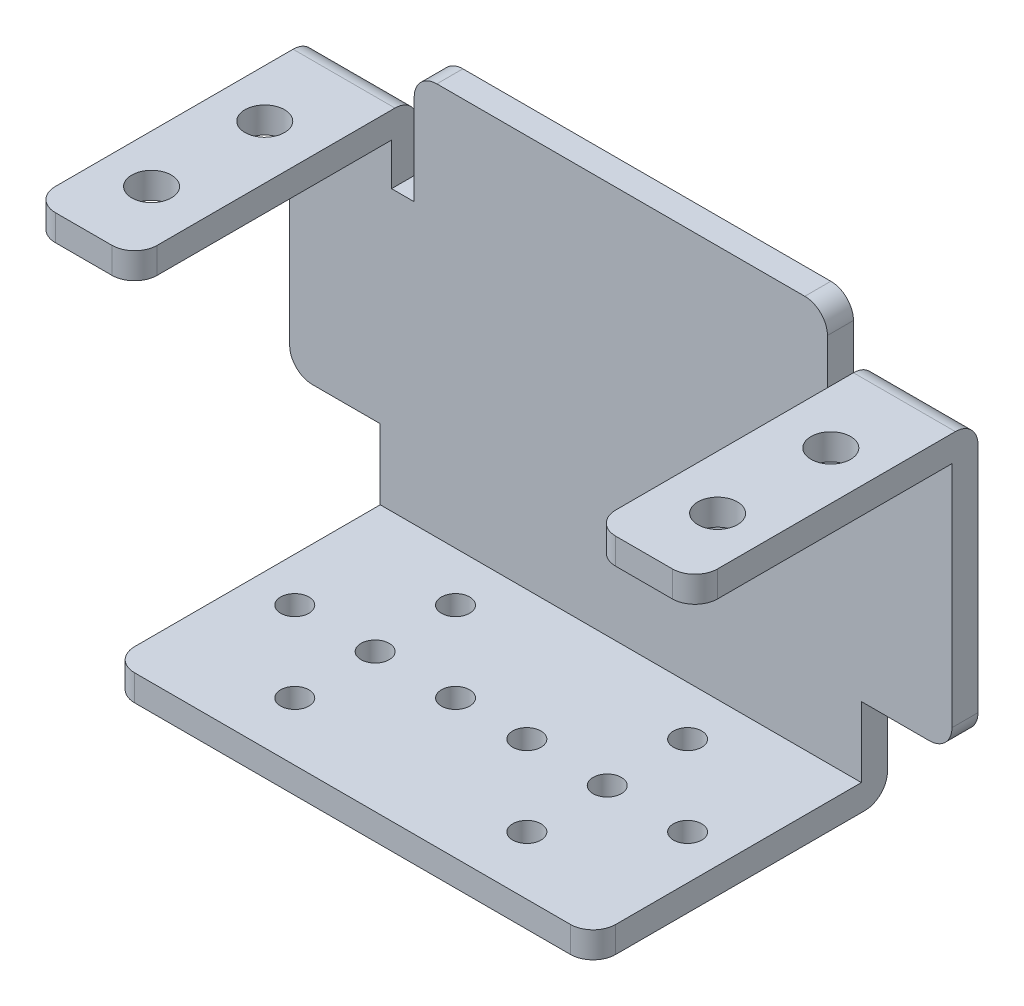
from build123d import *

# Parameters (mm, degrees)
SKETCH_2_W          = 42.5
SKETCH_2_H          = 26
EXTRUDE_1_DEPTH     = 2.3
EXTRUDE_3_DEPTH     = 2.3
SKETCH_5_W          = 9
SKETCH_5_H          = 2.3
EXTRUDE_6_DEPTH     = 25
FILLET_1_R          = 2
CUT_EXTRUDE_1_REACH = 47.973
SKETCH_6_R          = 1.75
CUT_EXTRUDE_2_REACH = 49.209
SKETCH_7_R          = 1.25


with BuildPart() as part:
    # 草图2 → 凸台-拉伸1 (new body)
    with BuildSketch(Plane(origin=(0, 0, 0), x_dir=(1, 0, 0), z_dir=(0, 1, 0))):
        Rectangle(SKETCH_2_W, SKETCH_2_H)
    extrude(amount=EXTRUDE_1_DEPTH)

    # 草图3 → 凸台-拉伸3 (add)
    with BuildSketch(Plane(origin=(0, 0, -13), x_dir=(-1, 0, 0), z_dir=(0, 0, -1))):
        Polygon((20.25, 33), (20.25, 26.981475126), (18.25, 26.981475126), (18.25, 37), (-18.25, 37), (-18.25, 26.981475126), (-20.25, 26.981475126), (-20.25, 33), (-29.25, 33), (-29.25, 8.5), (-21.25, 8.5), (-21.25, 0), (21.25, 0), (21.25, 8.5), (29.25, 8.5), (29.25, 33), align=None)
    extrude(amount=-EXTRUDE_3_DEPTH)

    # 草图5 → 凸台-拉伸6 (add)
    with BuildSketch(Plane(origin=(0, 0, -13), x_dir=(-1, 0, 0), z_dir=(0, 0, -1))):
        with Locations((-24.75, 31.85)):
            Rectangle(SKETCH_5_W, SKETCH_5_H)
        with Locations((24.75, 31.85)):
            Rectangle(SKETCH_5_W, SKETCH_5_H)
    extrude(amount=-EXTRUDE_6_DEPTH)

    # 圆角1
    fillet_1_edges = [part.edges().sort_by_distance(p)[0] for p in [
        (29.25, 8.5, -11.85),
        (18.25, 37, -11.85),
        (-18.25, 37, -11.85),
        (-29.25, 8.5, -11.85),
        (-24.75, 33, -13),
        (24.75, 33, -13),
        (0, 0, -13),
        (29.25, 31.85, 12),
        (20.25, 31.85, 12),
        (21.25, 1.15, 13),
        (-21.25, 1.15, 13),
        (-20.25, 31.85, 12),
        (-29.25, 31.85, 12),
    ]]
    fillet(fillet_1_edges, radius=FILLET_1_R)

    # 草图6 → 切除-拉伸1 (cut, up to next)
    with BuildSketch(Plane(origin=(0, 33, 0), x_dir=(1, 0, 0), z_dir=(0, 1, 0)), mode=Mode.PRIVATE) as cut_extrude_1_sk1:
        with Locations(Location((-25, -5.75, 0), (0, 0, 270))):
            Circle(SKETCH_6_R)
    cut_extrude_1_tool1 = extrude(cut_extrude_1_sk1.sketch, amount=-CUT_EXTRUDE_1_REACH, mode=Mode.PRIVATE) & part.part
    # 草图6 → 切除-拉伸1 (cut, up to next)
    with BuildSketch(Plane(origin=(0, 33, 0), x_dir=(1, 0, 0), z_dir=(0, 1, 0)), mode=Mode.PRIVATE) as cut_extrude_1_sk2:
        with Locations(Location((-25, 4.25, 0), (0, 0, 270))):
            Circle(SKETCH_6_R)
    cut_extrude_1_tool2 = extrude(cut_extrude_1_sk2.sketch, amount=-CUT_EXTRUDE_1_REACH, mode=Mode.PRIVATE) & part.part
    cut_extrude_1_1 = cut_extrude_1_tool1.solids().sort_by_distance((-25, 33, 5.75))[0]
    add(cut_extrude_1_1, mode=Mode.SUBTRACT)
    cut_extrude_1_2 = cut_extrude_1_tool2.solids().sort_by_distance((-25, 33, -4.25))[0]
    add(cut_extrude_1_2, mode=Mode.SUBTRACT)
    cut_extrude_1 = cut_extrude_1_1 + cut_extrude_1_2  # 切除-拉伸1 as one shape, for the pattern or mirror that repeats it

    # 草图7 → 切除-拉伸2 (cut, up to next)
    with BuildSketch(Plane(origin=(0, 2.3, 0), x_dir=(1, 0, 0), z_dir=(0, 1, 0)), mode=Mode.PRIVATE) as cut_extrude_2_sk1:
        with Locations(Location((-10.25, -0.75, 0), (0, 0, 270))):
            Circle(SKETCH_7_R)
    cut_extrude_2_tool1 = extrude(cut_extrude_2_sk1.sketch, amount=-CUT_EXTRUDE_2_REACH, mode=Mode.PRIVATE) & part.part
    # 草图7 → 切除-拉伸2 (cut, up to next)
    with BuildSketch(Plane(origin=(0, 2.3, 0), x_dir=(1, 0, 0), z_dir=(0, 1, 0)), mode=Mode.PRIVATE) as cut_extrude_2_sk2:
        with Locations(Location((-10.25, -7.85, 0), (0, 0, 270))):
            Circle(SKETCH_7_R)
    cut_extrude_2_tool2 = extrude(cut_extrude_2_sk2.sketch, amount=-CUT_EXTRUDE_2_REACH, mode=Mode.PRIVATE) & part.part
    # 草图7 → 切除-拉伸2 (cut, up to next)
    with BuildSketch(Plane(origin=(0, 2.3, 0), x_dir=(1, 0, 0), z_dir=(0, 1, 0)), mode=Mode.PRIVATE) as cut_extrude_2_sk3:
        with Locations(Location((-17.35, -0.75, 0), (0, 0, 270))):
            Circle(SKETCH_7_R)
    cut_extrude_2_tool3 = extrude(cut_extrude_2_sk3.sketch, amount=-CUT_EXTRUDE_2_REACH, mode=Mode.PRIVATE) & part.part
    # 草图7 → 切除-拉伸2 (cut, up to next)
    with BuildSketch(Plane(origin=(0, 2.3, 0), x_dir=(1, 0, 0), z_dir=(0, 1, 0)), mode=Mode.PRIVATE) as cut_extrude_2_sk4:
        with Locations(Location((-10.25, 6.35, 0), (0, 0, 270))):
            Circle(SKETCH_7_R)
    cut_extrude_2_tool4 = extrude(cut_extrude_2_sk4.sketch, amount=-CUT_EXTRUDE_2_REACH, mode=Mode.PRIVATE) & part.part
    # 草图7 → 切除-拉伸2 (cut, up to next)
    with BuildSketch(Plane(origin=(0, 2.3, 0), x_dir=(1, 0, 0), z_dir=(0, 1, 0)), mode=Mode.PRIVATE) as cut_extrude_2_sk5:
        with Locations(Location((-3.15, -0.75, 0), (0, 0, 270))):
            Circle(SKETCH_7_R)
    cut_extrude_2_tool5 = extrude(cut_extrude_2_sk5.sketch, amount=-CUT_EXTRUDE_2_REACH, mode=Mode.PRIVATE) & part.part
    cut_extrude_2_1 = cut_extrude_2_tool1.solids().sort_by_distance((-10.25, 2.3, 0.75))[0]
    add(cut_extrude_2_1, mode=Mode.SUBTRACT)
    cut_extrude_2_2 = cut_extrude_2_tool2.solids().sort_by_distance((-10.25, 2.3, 7.85))[0]
    add(cut_extrude_2_2, mode=Mode.SUBTRACT)
    cut_extrude_2_3 = cut_extrude_2_tool3.solids().sort_by_distance((-17.35, 2.3, 0.75))[0]
    add(cut_extrude_2_3, mode=Mode.SUBTRACT)
    cut_extrude_2_4 = cut_extrude_2_tool4.solids().sort_by_distance((-10.25, 2.3, -6.35))[0]
    add(cut_extrude_2_4, mode=Mode.SUBTRACT)
    cut_extrude_2_5 = cut_extrude_2_tool5.solids().sort_by_distance((-3.15, 2.3, 0.75))[0]
    add(cut_extrude_2_5, mode=Mode.SUBTRACT)
    cut_extrude_2 = cut_extrude_2_1 + cut_extrude_2_2 + cut_extrude_2_3 + cut_extrude_2_4 + cut_extrude_2_5  # 切除-拉伸2 as one shape, for the pattern or mirror that repeats it

    # 镜向1: 切除-拉伸1, 切除-拉伸2 across plane
    add(cut_extrude_1.mirror(Plane(origin=(0, 0, 0), x_dir=(0, 0, 1), z_dir=(1, 0, 0))), mode=Mode.SUBTRACT)
    add(cut_extrude_2.mirror(Plane(origin=(0, 0, 0), x_dir=(0, 0, 1), z_dir=(1, 0, 0))), mode=Mode.SUBTRACT)


solid = part.part
